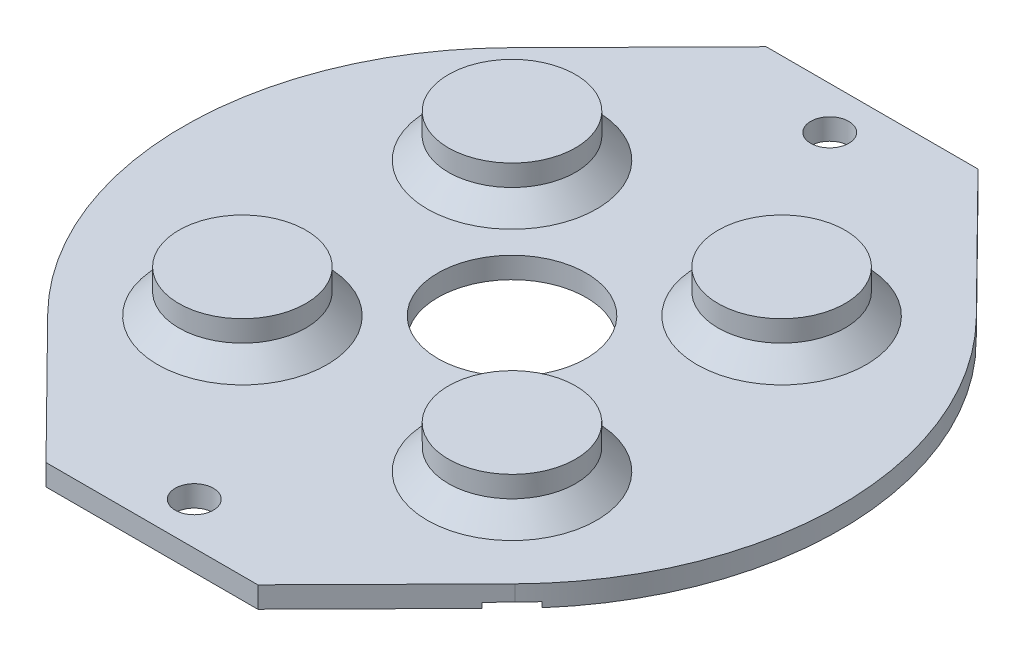
from build123d import *

# Parameters (mm, degrees)
BOSS_EXTRUDE1_DEPTH = 1
SKETCH2_R           = 3.5
CUT_EXTRUDE1_DEPTH  = 24.027157879
SKETCH3_R           = 3
BOSS_EXTRUDE2_DEPTH = 2
CIRPATTERN1_COUNT   = 4
CHAMFER1_SIZE       = 1
CIRPATTERN2_COUNT   = 4
CUT_EXTRUDE4_DEPTH  = 0.25
SKETCH6_R           = 2.5
BOSS_EXTRUDE3_DEPTH = 0.5
CIRPATTERN3_COUNT   = 4
SKETCH7_R           = 0.9
CUT_EXTRUDE5_DEPTH  = 24.092206478


with BuildPart() as part:
    # Sketch1 → Boss-Extrude1 (new body)
    with BuildSketch(Plane(origin=(0, 0, 0), x_dir=(1, 0, 0), z_dir=(0, 1, 0))):
        with BuildLine():
            Line((5, 17), (11.032262936, 10.887569725))
            ThreePointArc((11.032262936, 10.887569725), (15.5, 0), (11.032262936, -10.887569725))
            Line((11.032262936, -10.887569725), (5, -17))
            Line((5, -17), (-5, -17))
            Line((-5, -17), (-11.032262936, -10.887569725))
            ThreePointArc((-11.032262936, -10.887569725), (-15.5, 0), (-11.032262936, 10.887569725))
            Line((-11.032262936, 10.887569725), (-5, 17))
            Line((-5, 17), (5, 17))
        make_face()
    extrude(amount=BOSS_EXTRUDE1_DEPTH)

    # Sketch2 → Cut-Extrude1 (cut, through all)
    with BuildSketch(Plane(origin=(0, 1, 0), x_dir=(1, 0, 0), z_dir=(0, 1, 0))):
        with Locations(Location((0, 0, 0), (0, 0, 270))):
            Circle(SKETCH2_R)
    extrude(amount=-CUT_EXTRUDE1_DEPTH, mode=Mode.SUBTRACT)

    # Sketch3 → Boss-Extrude2 (add)
    with BuildSketch(Plane(origin=(0, 1, 0), x_dir=(1, 0, 0), z_dir=(0, 1, 0))):
        with Locations(Location((-6.363961031, 6.363961031, 0), (0, 0, 270))):
            Circle(SKETCH3_R)
    boss_extrude2 = extrude(amount=BOSS_EXTRUDE2_DEPTH)

    # CirPattern1: Boss-Extrude2 ×4 about axis
    cirpattern1_axis = Axis((0, 0, 0), (0, 1, 0))
    for i in range(1, CIRPATTERN1_COUNT):
        add(boss_extrude2.rotate(cirpattern1_axis, i * 360 / CIRPATTERN1_COUNT))

    # Chamfer1
    chamfer1_edges = [part.edges().sort_by_distance(p)[0] for p in [
        (-6.363961031, 1, -9.363961031),
        (-9.363961031, 1, 6.363961031),
        (6.363961031, 1, 9.363961031),
        (9.363961031, 1, -6.363961031),
    ]]
    chamfer(chamfer1_edges, length=CHAMFER1_SIZE)

    # Sketch4 → Cut-Revolve1 (revolve, cut)
    with BuildSketch(Plane(origin=(0, 0, 0), x_dir=(-0.7071067811865477, 0, -0.7071067811865475), z_dir=(0.7071067811865475, 0, -0.7071067811865477)), mode=Mode.PRIVATE) as cut_revolve1_sk:
        Polygon((12.5, 0), (9, 0), (9, 1.75), (11.5, 1.75), (12.5, 0.5), align=None)
    cut_revolve1 = revolve(cut_revolve1_sk.sketch.rotate(Axis((-6.363961031, 1, -6.363961031), (0, 1, 0)), 315), axis=Axis((-6.363961031, 1, -6.363961031), (0, 1, 0)), mode=Mode.SUBTRACT)

    # CirPattern2: Cut-Revolve1 ×4 about axis
    cirpattern2_axis = Axis((0, 0, 0), (0, 1, 0))
    for i in range(1, CIRPATTERN2_COUNT):
        add(cut_revolve1.rotate(cirpattern2_axis, i * 360 / CIRPATTERN2_COUNT), mode=Mode.SUBTRACT)

    # Sketch5 → Cut-Extrude4 (cut)
    with BuildSketch(Plane.XZ):
        with BuildLine():
            Line((-3.009859064, 7.363961031), (3.009859064, 7.363961031))
            ThreePointArc((3.009859064, 7.363961031), (2.863961031, 6.363961031), (3.009859064, 5.363961031))
            Line((3.009859064, 5.363961031), (-3.009859064, 5.363961031))
            ThreePointArc((-3.009859064, 5.363961031), (-2.863961031, 6.363961031), (-3.009859064, 7.363961031))
        make_face()
        with BuildLine():
            Line((-7.363961031, 3.009859064), (-7.363961031, -3.009859064))
            ThreePointArc((-7.363961031, -3.009859064), (-6.363961031, -2.863961031), (-5.363961031, -3.009859064))
            Line((-5.363961031, -3.009859064), (-5.363961031, 3.009859064))
            ThreePointArc((-5.363961031, 3.009859064), (-6.363961031, 2.863961031), (-7.363961031, 3.009859064))
        make_face()
        with BuildLine():
            Line((-3.009859064, -5.363961031), (3.009859064, -5.363961031))
            ThreePointArc((3.009859064, -5.363961031), (2.863961031, -6.363961031), (3.009859064, -7.363961031))
            Line((3.009859064, -7.363961031), (-3.009859064, -7.363961031))
            ThreePointArc((-3.009859064, -7.363961031), (-2.863961031, -6.363961031), (-3.009859064, -5.363961031))
        make_face()
        with BuildLine():
            Line((5.363961031, -3.009859064), (5.363961031, 3.009859064))
            ThreePointArc((5.363961031, 3.009859064), (6.363961031, 2.863961031), (7.363961031, 3.009859064))
            Line((7.363961031, 3.009859064), (7.363961031, -3.009859064))
            ThreePointArc((7.363961031, -3.009859064), (6.363961031, -2.863961031), (5.363961031, -3.009859064))
        make_face()
        with BuildLine():
            Line((8.028562495, 9.442776057), (10.257954735, 11.672168297))
            Line((10.257954735, 11.672168297), (11.032262936, 10.887569725))
            ThreePointArc((11.032262936, 10.887569725), (11.343108447, 10.563327637), (11.644428208, 10.230214646))
            Line((11.644428208, 10.230214646), (9.442776057, 8.028562495))
            ThreePointArc((9.442776057, 8.028562495), (8.838834765, 8.838834765), (8.028562495, 9.442776057))
        make_face()
        with BuildLine():
            Line((-8.028562495, 9.442776057), (-10.257954735, 11.672168297))
            Line((-10.257954735, 11.672168297), (-11.032262936, 10.887569725))
            ThreePointArc((-11.032262936, 10.887569725), (-11.343108447, 10.563327637), (-11.644428208, 10.230214646))
            Line((-11.644428208, 10.230214646), (-9.442776057, 8.028562495))
            ThreePointArc((-9.442776057, 8.028562495), (-8.838834765, 8.838834765), (-8.028562495, 9.442776057))
        make_face()
        with BuildLine():
            Line((-8.028562495, -9.442776057), (-10.257954735, -11.672168297))
            Line((-10.257954735, -11.672168297), (-11.032262936, -10.887569725))
            ThreePointArc((-11.032262936, -10.887569725), (-11.343108447, -10.563327637), (-11.644428208, -10.230214646))
            Line((-11.644428208, -10.230214646), (-9.442776057, -8.028562495))
            ThreePointArc((-9.442776057, -8.028562495), (-8.838834765, -8.838834765), (-8.028562495, -9.442776057))
        make_face()
        with BuildLine():
            Line((8.028562495, -9.442776057), (10.257954735, -11.672168297))
            Line((10.257954735, -11.672168297), (11.032262936, -10.887569725))
            ThreePointArc((11.032262936, -10.887569725), (11.343108447, -10.563327637), (11.644428208, -10.230214646))
            Line((11.644428208, -10.230214646), (9.442776057, -8.028562495))
            ThreePointArc((9.442776057, -8.028562495), (8.838834765, -8.838834765), (8.028562495, -9.442776057))
        make_face()
    extrude(amount=-CUT_EXTRUDE4_DEPTH, mode=Mode.SUBTRACT)

    # Sketch6 → Boss-Extrude3 (add)
    with BuildSketch(Plane.XZ.offset(-1.75)):
        with Locations(Location((-6.363961031, -6.363961031, 0), (0, 0, 270))):
            Circle(SKETCH6_R)
    boss_extrude3 = extrude(amount=BOSS_EXTRUDE3_DEPTH)

    # CirPattern3: Boss-Extrude3 ×4 about axis
    cirpattern3_axis = Axis((0, 0, 0), (0, 1, 0))
    for i in range(1, CIRPATTERN3_COUNT):
        add(boss_extrude3.rotate(cirpattern3_axis, i * 360 / CIRPATTERN3_COUNT))

    # Sketch7 → Cut-Extrude5 (cut, through all)
    with BuildSketch(Plane(origin=(0, 1, 0), x_dir=(1, 0, 0), z_dir=(0, 1, 0))):
        with Locations(Location((0, 15, 0), (0, 0, 270))):
            Circle(SKETCH7_R)
    cut_extrude5 = extrude(amount=-CUT_EXTRUDE5_DEPTH, mode=Mode.SUBTRACT)

    # Mirror1: Cut-Extrude5 across plane
    add(cut_extrude5.mirror(Plane.XY), mode=Mode.SUBTRACT)


solid = part.part
